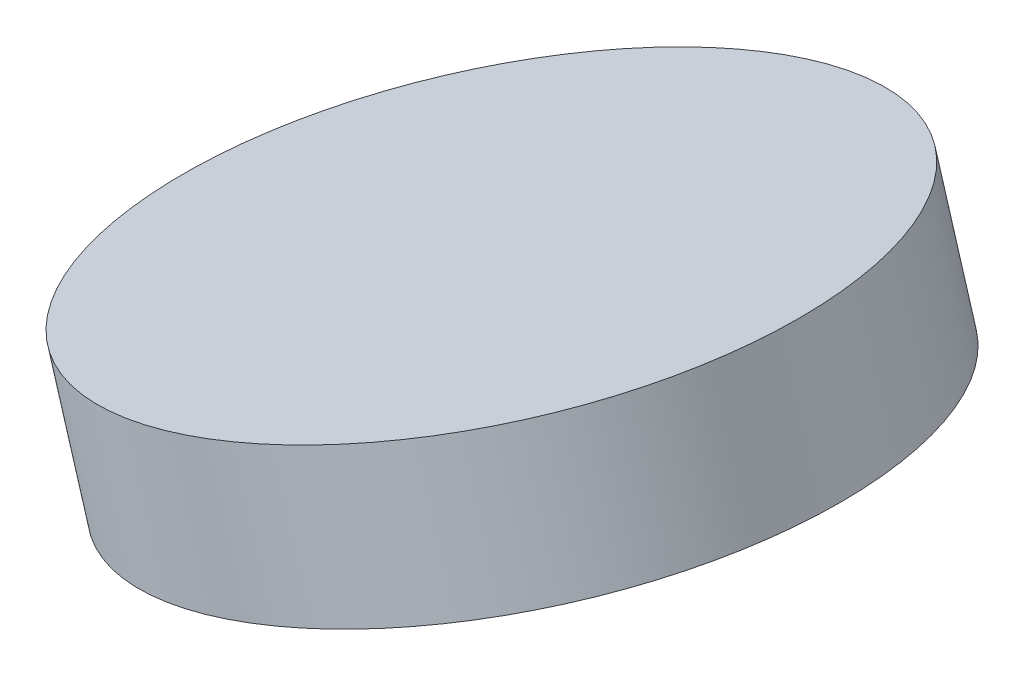
from build123d import *

# Parameters (mm, degrees)
SKETCH1_R           = 4.440371606
BOSS_EXTRUDE1_DEPTH = 2


with BuildPart() as part:
    # Sketch1 → Boss-Extrude1 (new body)
    with BuildSketch(Plane(origin=(-3.424007081, 11.501138009, 0), x_dir=(-0.9185845521656102, -0.273472069301996, -0.2853339233851978), z_dir=(0.2853339233851978, -0.9584281674521102, 0))):
        with Locations(Location((0, 0, 0), (0, 0, 163.42119018))):
            Circle(SKETCH1_R)
    extrude(amount=BOSS_EXTRUDE1_DEPTH)


solid = part.part
